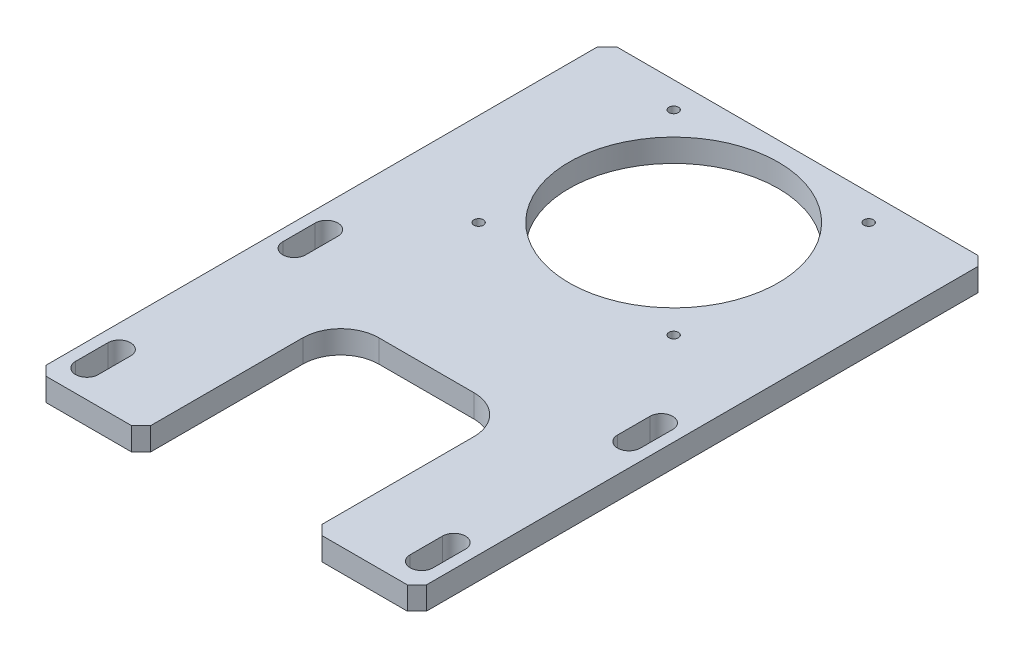
from build123d import *

# Parameters (mm, degrees)
SKETCH1_W             = 200
SKETCH1_H             = 300
BOSS_EXTRUDE1_DEPTH   = 12
CUT_EXTRUDE1_REACH    = 318.455
SKETCH2_W             = 90
SKETCH2_H             = 105
CUT_EXTRUDE2_REACH    = 318.455
SKETCH3_R             = 55
CUT_EXTRUDE3_REACH    = 318.455
M6X1_0_TAPPED_HOLE1_D = 5
FILLET1_R             = 20
CHAMFER1_SIZE         = 5


with BuildPart() as part:
    # Sketch1 → Boss-Extrude1 (new body)
    with BuildSketch(Plane(origin=(0, 0, 0), x_dir=(1, 0, 0), z_dir=(0, 1, 0))):
        with Locations((0, -150)):
            Rectangle(SKETCH1_W, SKETCH1_H)
    extrude(amount=BOSS_EXTRUDE1_DEPTH)

    # Sketch2 → Cut-Extrude1 (cut, up to next)
    with BuildSketch(Plane(origin=(0, 12, 0), x_dir=(1, 0, 0), z_dir=(0, 1, 0)), mode=Mode.PRIVATE) as cut_extrude1_sk1:
        with Locations((0, -247.5)):
            Rectangle(SKETCH2_W, SKETCH2_H)
    cut_extrude1_tool1 = extrude(cut_extrude1_sk1.sketch, amount=-CUT_EXTRUDE1_REACH, mode=Mode.PRIVATE) & part.part
    add(cut_extrude1_tool1.solids().sort_by_distance((0, 12, 247.5))[0], mode=Mode.SUBTRACT)

    # Sketch3 → Cut-Extrude2 (cut, up to next)
    with BuildSketch(Plane(origin=(0, 12, 0), x_dir=(1, 0, 0), z_dir=(0, 1, 0)), mode=Mode.PRIVATE) as cut_extrude2_sk1:
        with Locations(Location((0, -65, 0), (0, 0, 270))):
            Circle(SKETCH3_R)
    cut_extrude2_tool1 = extrude(cut_extrude2_sk1.sketch, amount=-CUT_EXTRUDE2_REACH, mode=Mode.PRIVATE) & part.part
    add(cut_extrude2_tool1.solids().sort_by_distance((0, 12, 65))[0], mode=Mode.SUBTRACT)

    # Sketch4 → Cut-Extrude3 (cut, up to next)
    with BuildSketch(Plane(origin=(0, 12, 0), x_dir=(1, 0, 0), z_dir=(0, 1, 0)), mode=Mode.PRIVATE) as cut_extrude3_sk1:
        with BuildLine():
            Line((-82, -268.5), (-82, -285.5))
            ThreePointArc((-82, -285.5), (-88, -291.5), (-94, -285.5))
            Line((-94, -285.5), (-94, -268.5))
            ThreePointArc((-94, -268.5), (-88, -262.5), (-82, -268.5))
        make_face()
    cut_extrude3_tool1 = extrude(cut_extrude3_sk1.sketch, amount=-CUT_EXTRUDE3_REACH, mode=Mode.PRIVATE) & part.part
    # Sketch4 → Cut-Extrude3 (cut, up to next)
    with BuildSketch(Plane(origin=(0, 12, 0), x_dir=(1, 0, 0), z_dir=(0, 1, 0)), mode=Mode.PRIVATE) as cut_extrude3_sk2:
        with BuildLine():
            Line((94, -268.5), (94, -285.5))
            ThreePointArc((94, -285.5), (88, -291.5), (82, -285.5))
            Line((82, -285.5), (82, -268.5))
            ThreePointArc((82, -268.5), (88, -262.5), (94, -268.5))
        make_face()
    cut_extrude3_tool2 = extrude(cut_extrude3_sk2.sketch, amount=-CUT_EXTRUDE3_REACH, mode=Mode.PRIVATE) & part.part
    # Sketch4 → Cut-Extrude3 (cut, up to next)
    with BuildSketch(Plane(origin=(0, 12, 0), x_dir=(1, 0, 0), z_dir=(0, 1, 0)), mode=Mode.PRIVATE) as cut_extrude3_sk3:
        with BuildLine():
            Line((-94, -176.5), (-94, -159.5))
            ThreePointArc((-94, -159.5), (-88, -153.5), (-82, -159.5))
            Line((-82, -159.5), (-82, -176.5))
            ThreePointArc((-82, -176.5), (-88, -182.5), (-94, -176.5))
        make_face()
    cut_extrude3_tool3 = extrude(cut_extrude3_sk3.sketch, amount=-CUT_EXTRUDE3_REACH, mode=Mode.PRIVATE) & part.part
    # Sketch4 → Cut-Extrude3 (cut, up to next)
    with BuildSketch(Plane(origin=(0, 12, 0), x_dir=(1, 0, 0), z_dir=(0, 1, 0)), mode=Mode.PRIVATE) as cut_extrude3_sk4:
        with BuildLine():
            Line((82, -176.5), (82, -159.5))
            ThreePointArc((82, -159.5), (88, -153.5), (94, -159.5))
            Line((94, -159.5), (94, -176.5))
            ThreePointArc((94, -176.5), (88, -182.5), (82, -176.5))
        make_face()
    cut_extrude3_tool4 = extrude(cut_extrude3_sk4.sketch, amount=-CUT_EXTRUDE3_REACH, mode=Mode.PRIVATE) & part.part
    add(cut_extrude3_tool1.solids().sort_by_distance((-88, 12, 277))[0], mode=Mode.SUBTRACT)
    add(cut_extrude3_tool2.solids().sort_by_distance((88, 12, 277))[0], mode=Mode.SUBTRACT)
    add(cut_extrude3_tool3.solids().sort_by_distance((-88, 12, 168))[0], mode=Mode.SUBTRACT)
    add(cut_extrude3_tool4.solids().sort_by_distance((88, 12, 168))[0], mode=Mode.SUBTRACT)

    # M6x1.0 Tapped Hole1 (through all)
    with Locations(Plane(origin=(0, 12, 0), x_dir=(-1, 0, 0), z_dir=(0, 1, 0))):
        with Locations((-51.265241636, 116.265241636), (51.265241636, 116.265241636), (-51.265241636, 13.734758364), (51.265241636, 13.734758364)):
            Hole(M6X1_0_TAPPED_HOLE1_D / 2)

    # Fillet1
    fillet1_edges = [part.edges().sort_by_distance(p)[0] for p in [
        (-45, 6, 195),
        (45, 6, 195),
    ]]
    fillet(fillet1_edges, radius=FILLET1_R)

    # Chamfer1
    chamfer1_edges = [part.edges().sort_by_distance(p)[0] for p in [
        (-45, 6, 300),
        (45, 6, 300),
        (-100, 6, 0),
        (100, 6, 0),
        (100, 6, 300),
        (-100, 6, 300),
    ]]
    chamfer(chamfer1_edges, length=CHAMFER1_SIZE)


solid = part.part
